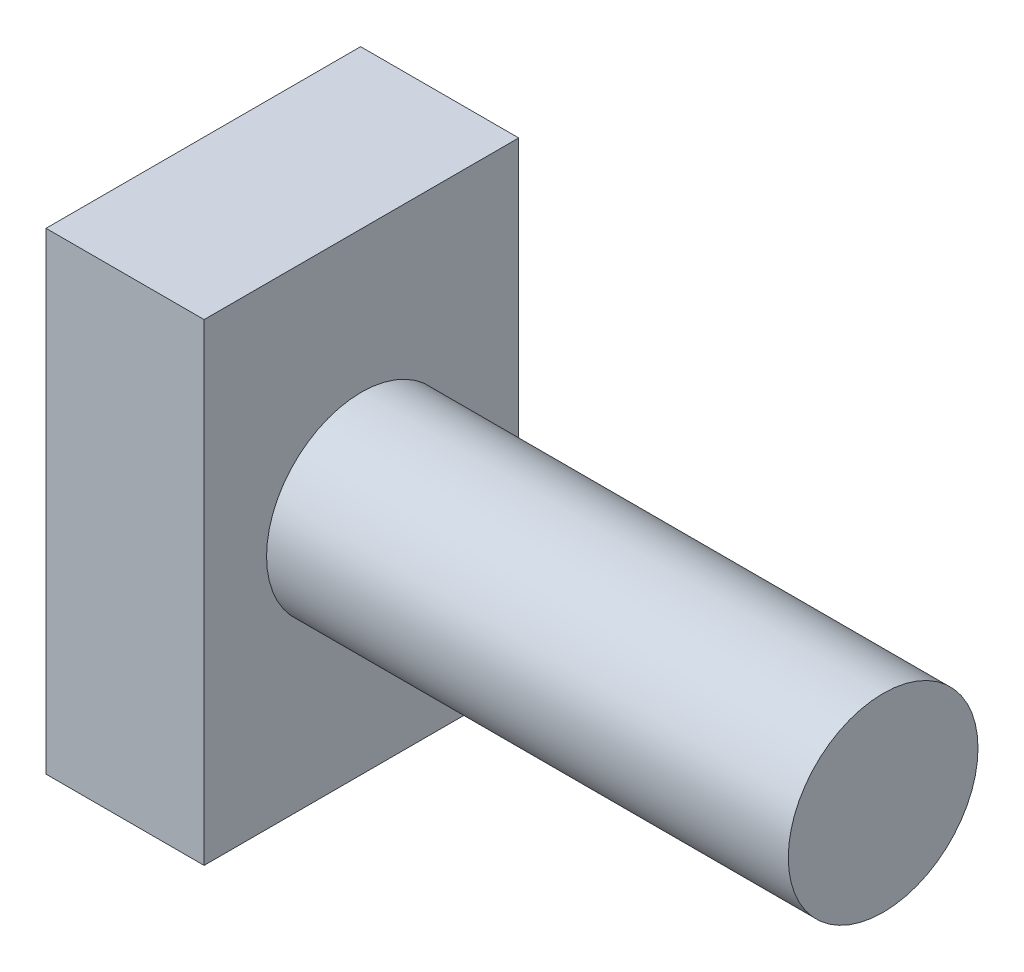
from build123d import *

# Parameters (mm, degrees)
SKETCH_1_W          = 10
SKETCH_1_H          = 19.9
EXTRUDE_1_DEPTH     = 29.9
SKETCH_4_R          = 6
EXTRUDE_2_DEPTH     = 33
SKETCH_7_R          = 2
CUT_EXTRUDE_1_DEPTH = 9.6


with BuildPart() as part:
    # Эскиз1 → Бобышка-Вытянуть1 (new body)
    with BuildSketch(Plane(origin=(0, 0, 0), x_dir=(1, 0, 0), z_dir=(0, 1, 0))):
        Rectangle(SKETCH_1_W, SKETCH_1_H)
    extrude(amount=EXTRUDE_1_DEPTH)

    # Эскиз4 → Бобышка-Вытянуть2 (add)
    with BuildSketch(Plane(origin=(5, 0, 0), x_dir=(0, 0, -1), z_dir=(1, 0, 0))):
        with Locations((0, 14.95)):
            Circle(SKETCH_4_R)
    extrude(amount=EXTRUDE_2_DEPTH)

    # Эскиз7 → Вырез-Вытянуть1 (cut)
    with BuildSketch(Plane.ZY.offset(5)):
        with Locations((0, 14.95)):
            Circle(SKETCH_7_R)
    extrude(amount=-CUT_EXTRUDE_1_DEPTH, mode=Mode.SUBTRACT)


solid = part.part
